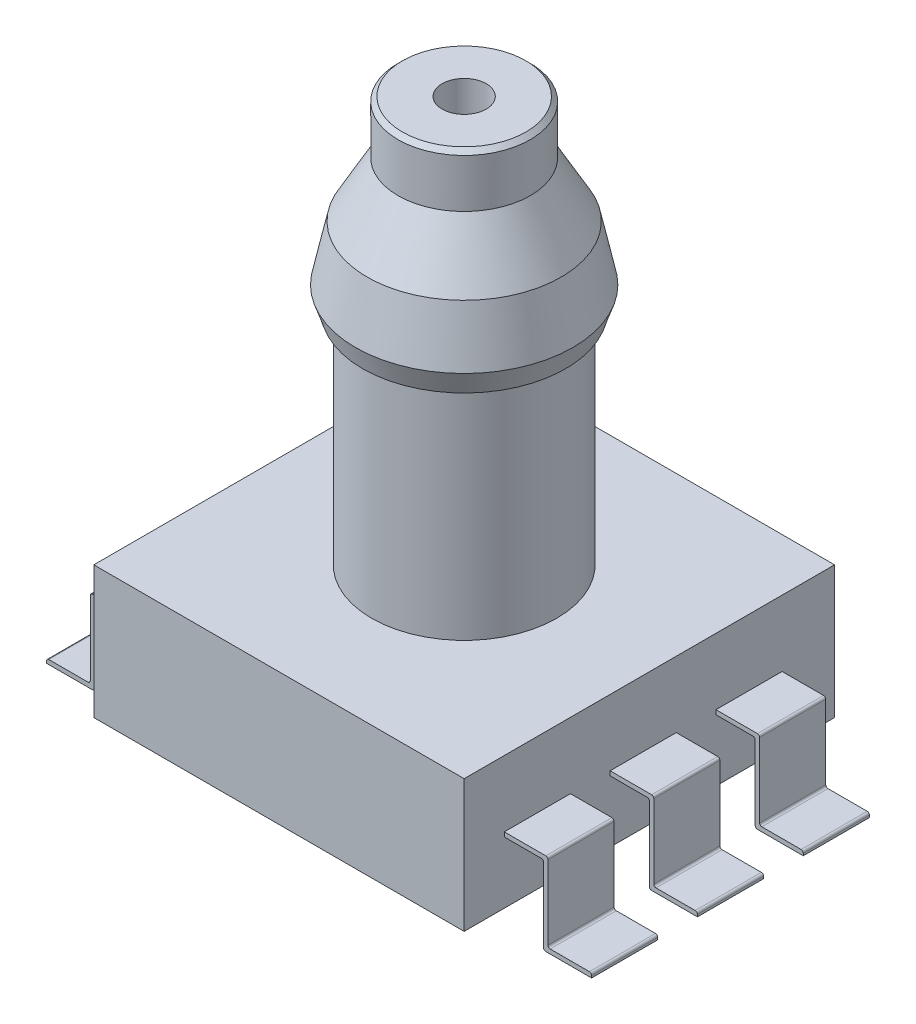
from build123d import *

# Parameters (mm, degrees)
SKETCH1_W            = 8.4
SKETCH1_H            = 8.4
BOSS_EXTRUDE1_DEPTH  = 3
BOSS_EXTRUDE2_DEPTH  = 1.5
LPATTERN1_COUNT      = 3
LPATTERN1_PITCH      = 2.4
MIRROR1_COPY_1_DEPTH = 1.5
MIRROR1_COPY_2_DEPTH = 1.5
SKETCH3_R            = 2.1
BOSS_EXTRUDE3_DEPTH  = 5
SKETCH5_R            = 1.5
BOSS_EXTRUDE4_DEPTH  = 1.2
CHAMFER1_SIZE        = 0.1
SKETCH7_R            = 0.5
CUT_EXTRUDE1_DEPTH   = 9.2


with BuildPart() as part:
    # Sketch1 → Boss-Extrude1 (new body)
    with BuildSketch(Plane(origin=(0, 0, 0), x_dir=(1, 0, 0), z_dir=(0, 1, 0))):
        Rectangle(SKETCH1_W, SKETCH1_H)
    extrude(amount=BOSS_EXTRUDE1_DEPTH)


with BuildPart() as body_2:
    # Sketch2 → Boss-Extrude2 (new body)
    with BuildSketch(Plane.XY.offset(3.29)):
        with BuildLine():
            Line((4.2, 1.5), (5.14, 1.5))
            ThreePointArc((5.14, 1.5), (5.175355339, 1.485355339), (5.19, 1.45))
            Line((5.19, 1.45), (5.19, -0.23))
            ThreePointArc((5.19, -0.23), (5.204644661, -0.265355339), (5.24, -0.28))
            Line((5.24, -0.28), (6.13, -0.28))
            ThreePointArc((6.13, -0.28), (6.165355339, -0.294644661), (6.18, -0.33))
            Line((6.18, -0.33), (6.18, -0.38))
            Line((6.18, -0.38), (5.14, -0.38))
            ThreePointArc((5.14, -0.38), (5.104644661, -0.365355339), (5.09, -0.33))
            Line((5.09, -0.33), (5.09, 1.35))
            ThreePointArc((5.09, 1.35), (5.075355339, 1.385355339), (5.04, 1.4))
            Line((5.04, 1.4), (4.2, 1.4))
            Line((4.2, 1.4), (4.2, 1.5))
        make_face()
    boss_extrude2 = extrude(amount=-BOSS_EXTRUDE2_DEPTH)


with BuildPart() as part_1:
    add(part.part)

    # LPattern1: Boss-Extrude2 ×3
    with Locations(*[(0, 0, -i * LPATTERN1_PITCH) for i in range(1, LPATTERN1_COUNT)]):
        add(boss_extrude2)

    # Mirror1: Boss-Extrude2 across plane
    add(boss_extrude2.mirror(Plane(origin=(0, 0, 0), x_dir=(0, 0, 1), z_dir=(1, 0, 0))))

    # Mirror1 copy 1 sketch → Mirror1 copy 1 (add)
    with BuildSketch(Plane(origin=(0, 0, 0.89), x_dir=(-1, 0, 0), z_dir=(0, 0, 1))):
        with BuildLine():
            Line((4.2, -1.5), (5.14, -1.5))
            ThreePointArc((5.14, -1.5), (5.175355339, -1.485355339), (5.19, -1.45))
            Line((5.19, -1.45), (5.19, 0.23))
            ThreePointArc((5.19, 0.23), (5.204644661, 0.265355339), (5.24, 0.28))
            Line((5.24, 0.28), (6.13, 0.28))
            ThreePointArc((6.13, 0.28), (6.165355339, 0.294644661), (6.18, 0.33))
            Line((6.18, 0.33), (6.18, 0.38))
            Line((6.18, 0.38), (5.14, 0.38))
            ThreePointArc((5.14, 0.38), (5.104644661, 0.365355339), (5.09, 0.33))
            Line((5.09, 0.33), (5.09, -1.35))
            ThreePointArc((5.09, -1.35), (5.075355339, -1.385355339), (5.04, -1.4))
            Line((5.04, -1.4), (4.2, -1.4))
            Line((4.2, -1.4), (4.2, -1.5))
        make_face()
    extrude(amount=-MIRROR1_COPY_1_DEPTH)

    # Mirror1 copy 2 sketch → Mirror1 copy 2 (add)
    with BuildSketch(Plane(origin=(0, 0, -1.51), x_dir=(-1, 0, 0), z_dir=(0, 0, 1))):
        with BuildLine():
            Line((4.2, -1.5), (5.14, -1.5))
            ThreePointArc((5.14, -1.5), (5.175355339, -1.485355339), (5.19, -1.45))
            Line((5.19, -1.45), (5.19, 0.23))
            ThreePointArc((5.19, 0.23), (5.204644661, 0.265355339), (5.24, 0.28))
            Line((5.24, 0.28), (6.13, 0.28))
            ThreePointArc((6.13, 0.28), (6.165355339, 0.294644661), (6.18, 0.33))
            Line((6.18, 0.33), (6.18, 0.38))
            Line((6.18, 0.38), (5.14, 0.38))
            ThreePointArc((5.14, 0.38), (5.104644661, 0.365355339), (5.09, 0.33))
            Line((5.09, 0.33), (5.09, -1.35))
            ThreePointArc((5.09, -1.35), (5.075355339, -1.385355339), (5.04, -1.4))
            Line((5.04, -1.4), (4.2, -1.4))
            Line((4.2, -1.4), (4.2, -1.5))
        make_face()
    extrude(amount=-MIRROR1_COPY_2_DEPTH)

    # Sketch3 → Boss-Extrude3 (add)
    with BuildSketch(Plane(origin=(0, 3, 0), x_dir=(1, 0, 0), z_dir=(0, 1, 0))):
        with Locations(Location((0, 0, 0), (0, 0, 270))):
            Circle(SKETCH3_R)
    extrude(amount=BOSS_EXTRUDE3_DEPTH)

    # Sketch4 → Revolve1 (revolve)
    with BuildSketch(Plane.XY, mode=Mode.PRIVATE) as revolve1_sk:
        Polygon((0, 8), (-2.3, 8), (-2.465, 8.5), (-2.2, 9.75), (-1.5, 11), (0, 11), align=None)
    revolve(revolve1_sk.sketch.rotate(Axis((0, 8, 0), (0, 1, 0)), 270), axis=Axis((0, 8, 0), (0, 1, 0)))

    # Sketch5 → Boss-Extrude4 (add)
    with BuildSketch(Plane(origin=(0, 11, 0), x_dir=(1, 0, 0), z_dir=(0, 1, 0))):
        with Locations(Location((0, 0, 0), (0, 0, 270))):
            Circle(SKETCH5_R)
    extrude(amount=BOSS_EXTRUDE4_DEPTH)

    # Chamfer1
    chamfer1_edges = [part_1.edges().sort_by_distance(p)[0] for p in [
        (0, 12.2, -1.5),
    ]]
    chamfer(chamfer1_edges, length=CHAMFER1_SIZE)

    # Sketch7 → Cut-Extrude1 (cut)
    with BuildSketch(Plane(origin=(0, 12.2, 0), x_dir=(1, 0, 0), z_dir=(0, 1, 0))):
        with Locations(Location((0, 0, 0), (0, 0, 270))):
            Circle(SKETCH7_R)
    extrude(amount=-CUT_EXTRUDE1_DEPTH, mode=Mode.SUBTRACT)


solid = Compound([body_2.part, part_1.part])
